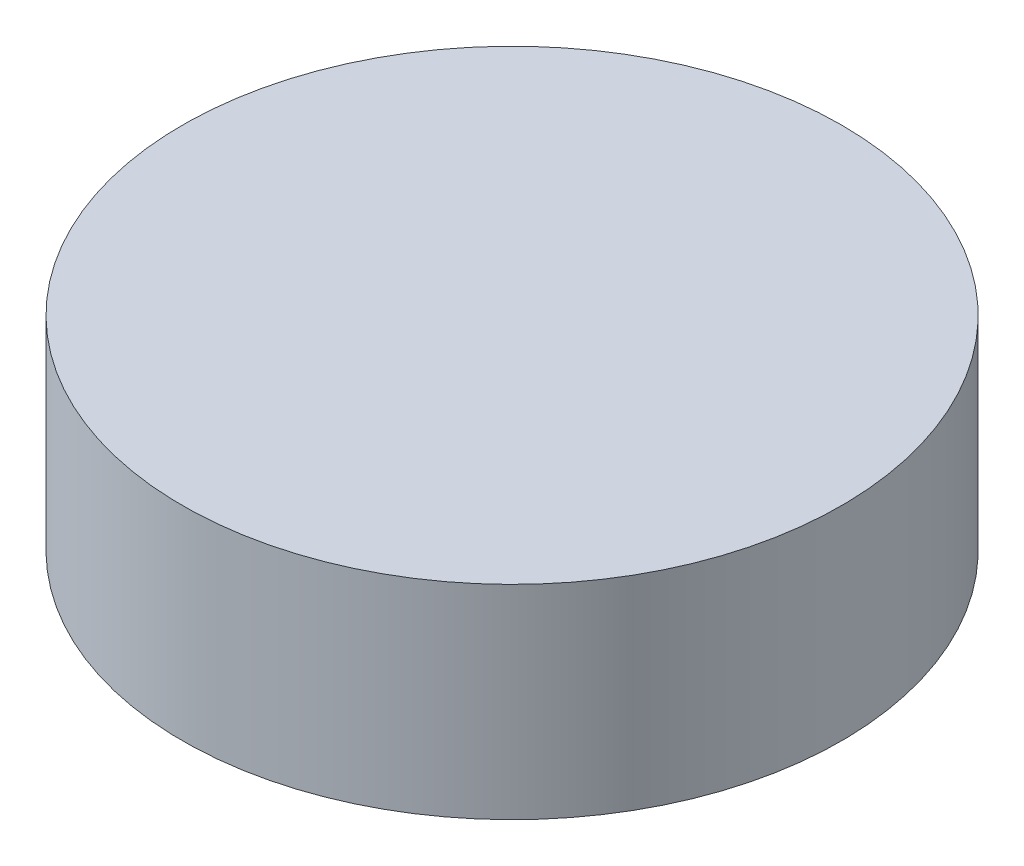
from build123d import *

# Parameters (mm, degrees)
SKETCH2_R           = 61.6204
BOSS_EXTRUDE1_DEPTH = 19.05


with BuildPart() as part:
    # Sketch2 → Boss-Extrude1 (new, symmetric)
    with BuildSketch(Plane(origin=(0, 0, 0), x_dir=(1, 0, 0), z_dir=(0, 1, 0))):
        with Locations(Location((0, 0, 0), (0, 0, 90))):
            Circle(SKETCH2_R)
    extrude(amount=BOSS_EXTRUDE1_DEPTH, both=True)


solid = part.part
